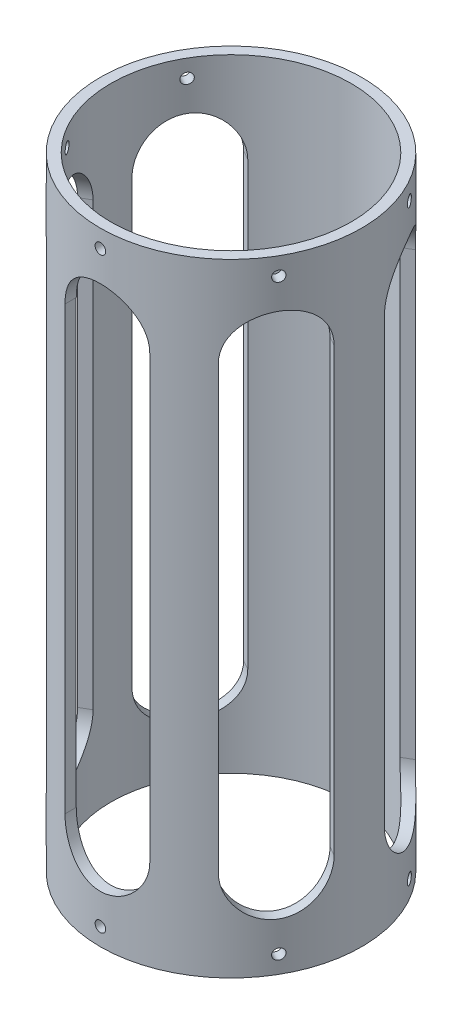
from build123d import *

# Parameters (mm, degrees)
SKETCH1_R                          = 37
SKETCH1_R_2                        = 34
TUBE_BASE_EXTRUDE_DEPTH            = 176.2
SKETCH2_R                          = 1.5
WEIGHT_RELIEF_AND_SCREW_HOLE_DEPTH = 184.805440616
CIRPATTERN1_COUNT                  = 3
CIRPATTERN1_ANGLE                  = 120
CIRPATTERN2_COUNT                  = 3
CIRPATTERN2_ANGLE                  = 120


with BuildPart() as part:
    # Sketch1 → TUBE BASE EXTRUDE (new body)
    with BuildSketch(Plane(origin=(0, 0, 0), x_dir=(1, 0, 0), z_dir=(0, 1, 0))):
        with Locations(Location((0, 0, 0), (0, 0, 270))):
            Circle(SKETCH1_R)
        with Locations(Location((0, 0, 0), (0, 0, 270))):
            Circle(SKETCH1_R_2, mode=Mode.SUBTRACT)
    extrude(amount=TUBE_BASE_EXTRUDE_DEPTH)

    # Sketch2 → WEIGHT RELIEF AND SCREW HOLE (cut, through all)
    with BuildSketch(Plane.XY):
        with Locations(Location((0, 5, 0), (0, 0, 90.000000053))):
            Circle(SKETCH2_R)
        with Locations(Location((0, 171.2, 0), (0, 0, 90.000000053))):
            Circle(SKETCH2_R)
        with BuildLine():
            Line((-12, 25.6), (-12, 150.6))
            ThreePointArc((-12, 150.6), (0, 162.6), (12, 150.6))
            Line((12, 150.6), (12, 25.6))
            ThreePointArc((12, 25.6), (0, 13.6), (-12, 25.6))
        make_face()
    weight_relief_and_screw_hole = extrude(amount=WEIGHT_RELIEF_AND_SCREW_HOLE_DEPTH, mode=Mode.SUBTRACT)

    # CirPattern1: WEIGHT RELIEF AND SCREW HOLE ×3 about axis
    cirpattern1_axis = Axis((0, 0, 0), (0, -1, 0))
    for i in range(1, CIRPATTERN1_COUNT):
        add(weight_relief_and_screw_hole.rotate(cirpattern1_axis, i * CIRPATTERN1_ANGLE / (CIRPATTERN1_COUNT - 1)), mode=Mode.SUBTRACT)

    # CirPattern2: WEIGHT RELIEF AND SCREW HOLE ×3 about axis
    cirpattern2_axis = Axis((0, 0, 0), (0, 1, 0))
    for i in range(1, CIRPATTERN2_COUNT):
        add(weight_relief_and_screw_hole.rotate(cirpattern2_axis, i * CIRPATTERN2_ANGLE / (CIRPATTERN2_COUNT - 1)), mode=Mode.SUBTRACT)


solid = part.part
